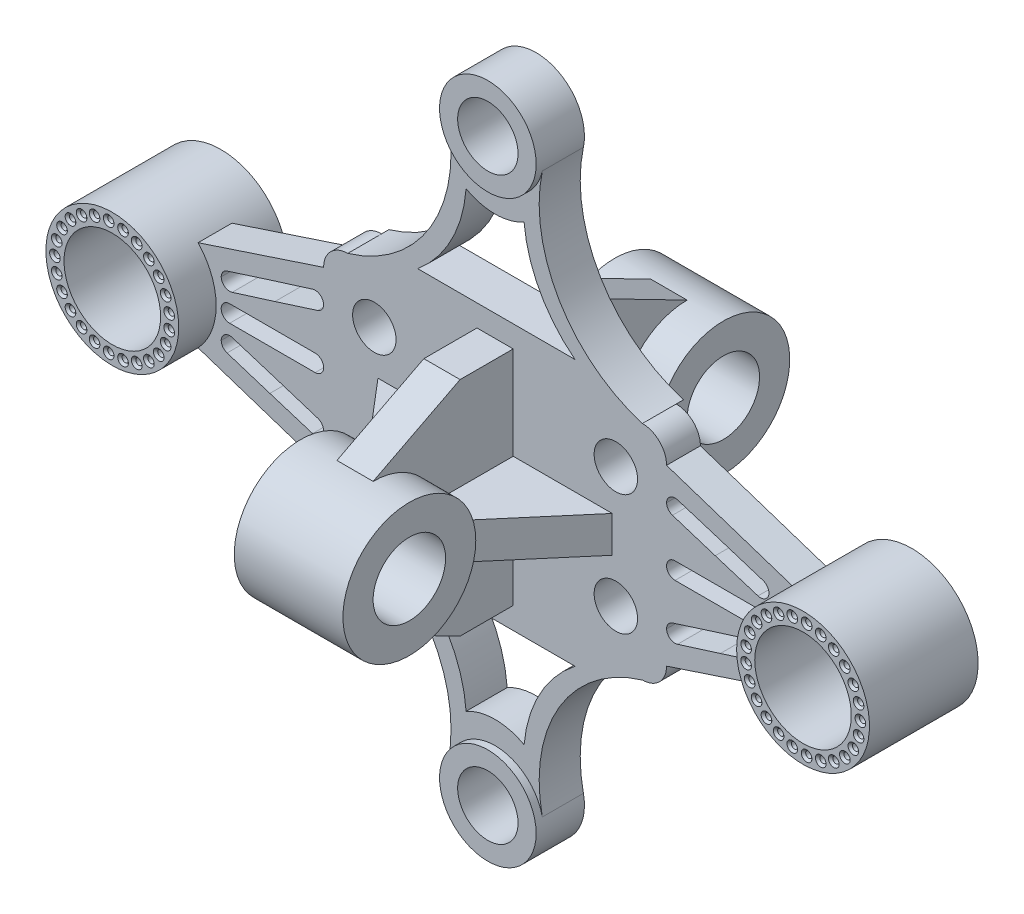
from build123d import *

# Parameters (mm, degrees)
SKETCH1_W                                       = 92
SKETCH1_H                                       = 142
SKETCH1_R                                       = 9
BOSS_EXTRUDE1_DEPTH                             = 14
FILLET1_R                                       = 10
BOSS_EXTRUDE2_DEPTH                             = 22.5
BOSS_EXTRUDE2_DEPTH_BACK                        = 22.5
SKETCH2_R                                       = 27.5
BOSS_EXTRUDE3_DEPTH                             = 7.5
BOSS_EXTRUDE3_DEPTH_BACK                        = 7.5
RIB32_REACH                                     = 132.603
SKETCH8_WALL_W                                  = 303.284863468
SKETCH8_WALL_H                                  = 15
SKETCH9_R                                       = 15
CUT_EXTRUDE1_DEPTH                              = 145.078103819
BOSS_EXTRUDE4_DEPTH                             = 22.5
BOSS_EXTRUDE4_DEPTH_BACK                        = 22.5
SKETCH11_R                                      = 27.5
SKETCH11_R_2                                    = 20
BOSS_EXTRUDE5_DEPTH                             = 7
BOSS_EXTRUDE5_DEPTH_BACK                        = 7
CSK_FOR_M2_FLAT_HEAD_MACHINE_SCREW2_D           = 2.6
CSK_FOR_M2_FLAT_HEAD_MACHINE_SCREW2_CSINK_D     = 4.4
CSK_FOR_M2_FLAT_HEAD_MACHINE_SCREW2_CSINK_ANGLE = 90
CIRPATTERN1_COUNT                               = 25
CUT_EXTRUDE2_DEPTH                              = 203.698051298
BOSS_EXTRUDE6_DEPTH                             = 10
BOSS_EXTRUDE6_DEPTH_BACK                        = 10
SKETCH19_R                                      = 20
SKETCH19_R_2                                    = 12.5
BOSS_EXTRUDE7_DEPTH                             = 7
BOSS_EXTRUDE7_DEPTH_BACK                        = 10


with BuildPart() as part:
    # Sketch1 → Boss-Extrude1 (new body)
    with BuildSketch(Plane(origin=(0, 0, 0), x_dir=(0, 1, 0), z_dir=(0, 0, 1))):
        Rectangle(SKETCH1_W, SKETCH1_H)
        with Locations(Location((-25, -50, 0), (0, 0, 270))):
            Circle(SKETCH1_R, mode=Mode.SUBTRACT)
        with Locations(Location((-25, 50, 0), (0, 0, 270))):
            Circle(SKETCH1_R, mode=Mode.SUBTRACT)
        with Locations(Location((25, 50, 0), (0, 0, 270))):
            Circle(SKETCH1_R, mode=Mode.SUBTRACT)
        with Locations(Location((25, -50, 0), (0, 0, 270))):
            Circle(SKETCH1_R, mode=Mode.SUBTRACT)
    extrude(amount=BOSS_EXTRUDE1_DEPTH)

    # Fillet1
    fillet1_edges = [part.edges().sort_by_distance(p)[0] for p in [
        (71, 46, 7),
        (71, -46, 7),
        (-71, -46, 7),
        (-71, 46, 7),
    ]]
    fillet(fillet1_edges, radius=FILLET1_R)



with BuildPart() as body_2:
    # Sketch2 → Boss-Extrude2 (new, two sides: drawn at the far end of the back side and taken through both)
    with BuildSketch(Plane.YZ.offset(-BOSS_EXTRUDE2_DEPTH_BACK)):
        with Locations(Location((0, 72, 0), (0, 0, 270))):
            Circle(SKETCH2_R)
    extrude(amount=BOSS_EXTRUDE2_DEPTH + BOSS_EXTRUDE2_DEPTH_BACK)


with BuildPart() as part_1:
    add(part.part)

    add(body_2.part)  # Boss-Extrude3 merges body 2
    # Sketch7 → Boss-Extrude3 (add, two sides: drawn at the far end of the back side and taken through both)
    with BuildSketch(Plane.YZ.offset(-BOSS_EXTRUDE3_DEPTH_BACK)):
        with BuildLine():
            Line((-46, 14), (-46, 36))
            Line((-46, 36), (-27.5, 72))
            ThreePointArc((-27.5, 72), (0, 46.820837438), (27.5, 72))
            Line((27.5, 72), (46, 36))
            Line((46, 36), (46, 14))
            Line((46, 14), (-46, 14))
        make_face()
    extrude(amount=BOSS_EXTRUDE3_DEPTH + BOSS_EXTRUDE3_DEPTH_BACK)

    # Sketch8 wall → Rib32 (add, up to next)
    with BuildSketch(Plane(origin=(35.5, 0, 29.25), x_dir=(0.648734176014, 0, -0.761015091093), z_dir=(-0.761015091093, 0, -0.648734176014)), mode=Mode.PRIVATE) as rib32_sk1:
        Rectangle(SKETCH8_WALL_W, SKETCH8_WALL_H)
    rib32_tool1 = extrude(rib32_sk1.sketch, amount=RIB32_REACH, mode=Mode.PRIVATE) - part_1.part
    rib32 = rib32_tool1.solids().sort_by_distance((35.5, 0, 29.25))[0]
    add(rib32)

    # Mirror1: Rib32 across plane
    add(rib32.mirror(Plane(origin=(0, 0, 0), x_dir=(0, 0, 1), z_dir=(1, 0, 0))))

    # Sketch9 → Cut-Extrude1 (cut, through all)
    with BuildSketch(Plane.YZ.offset(22.5)):
        with Locations(Location((0, 72, 0), (0, 0, 270))):
            Circle(SKETCH9_R)
    extrude(amount=-CUT_EXTRUDE1_DEPTH, mode=Mode.SUBTRACT)

    # Mirror3: part across plane


with BuildPart() as part_2:
    add(part_1.part)
    add(part_1.part.mirror(Plane.XY.offset(7)))



with BuildPart() as body_2_2:
    # Sketch11 → Boss-Extrude4 (new, two sides: drawn at the far end of the back side and taken through both)
    with BuildSketch(Plane(origin=(0, 0, 7), x_dir=(0, 1, 0), z_dir=(0, 0, 1)).offset(-BOSS_EXTRUDE4_DEPTH_BACK)):
        with Locations(Location((0, 143, 0), (0, 0, 270))):
            Circle(SKETCH11_R)
        with Locations(Location((0, 143, 0), (0, 0, 270))):
            Circle(SKETCH11_R_2, mode=Mode.SUBTRACT)
    extrude(amount=BOSS_EXTRUDE4_DEPTH + BOSS_EXTRUDE4_DEPTH_BACK)


with BuildPart() as part_3:
    add(part_2.part)

    add(body_2_2.part)  # Boss-Extrude5 merges body 2 2
    # Sketch12 → Boss-Extrude5 (add, two sides: drawn at the far end of the back side and taken through both)
    with BuildSketch(Plane(origin=(0, 0, 7), x_dir=(0, 1, 0), z_dir=(0, 0, 1)).offset(-BOSS_EXTRUDE5_DEPTH_BACK)):
        with BuildLine():
            Line((-18.848192646, 122.97512462), (-36, 71))
            Line((-36, 71), (36, 71))
            Line((36, 71), (18.848192646, 122.97512462))
            ThreePointArc((18.848192646, 122.97512462), (0, 115.5), (-18.848192646, 122.97512462))
        make_face()
    extrude(amount=BOSS_EXTRUDE5_DEPTH + BOSS_EXTRUDE5_DEPTH_BACK)

    # CSK for M2 Flat Head Machine Screw2 (through all)
    with Locations(Plane.XY.offset(29.5)):
        with Locations((-166.75, 0)):
            csk_for_m2_flat_head_machine_screw2 = CounterSinkHole(CSK_FOR_M2_FLAT_HEAD_MACHINE_SCREW2_D / 2, CSK_FOR_M2_FLAT_HEAD_MACHINE_SCREW2_CSINK_D / 2, counter_sink_angle=CSK_FOR_M2_FLAT_HEAD_MACHINE_SCREW2_CSINK_ANGLE)

    # CirPattern1: CSK for M2 Flat Head Machine Screw2 ×25 about axis
    cirpattern1_axis = Axis((-143, 0, 0), (0, 0, 1))
    for i in range(1, CIRPATTERN1_COUNT):
        add(csk_for_m2_flat_head_machine_screw2.rotate(cirpattern1_axis, i * 360 / CIRPATTERN1_COUNT), mode=Mode.SUBTRACT)

    # Sketch18 → Cut-Extrude2 (cut, through all)
    with BuildSketch(Plane.XY.offset(14)):
        with BuildLine():
            Line((-110.955501553, 14.788740235), (-75.547122656, 25.890641216))
            ThreePointArc((-75.547122656, 25.890641216), (-71.160309274, 23.598073146), (-73.452877344, 19.211259765))
            Line((-73.452877344, 19.211259765), (-108.861256242, 8.109358784))
            ThreePointArc((-108.861256242, 8.109358784), (-113.248069623, 10.401926854), (-110.955501553, 14.788740235))
        make_face()
        with BuildLine():
            Line((-108.845035715, -8.019829968), (-73.436656817, -19.311046768))
            ThreePointArc((-73.436656817, -19.311046768), (-71.165438368, -23.708951583), (-75.563343183, -25.980170032))
            Line((-75.563343183, -25.980170032), (-110.971722081, -14.688953232))
            ThreePointArc((-110.971722081, -14.688953232), (-113.242940529, -10.291048417), (-108.845035715, -8.019829968))
        make_face()
        with BuildLine():
            Line((-109.908378898, 3.5), (-74.5, 3.5))
            ThreePointArc((-74.5, 3.5), (-71, 0), (-74.5, -3.5))
            Line((-74.5, -3.5), (-109.908378898, -3.5))
            ThreePointArc((-109.908378898, -3.5), (-113.408378898, 0), (-109.908378898, 3.5))
        make_face()
    extrude(amount=-CUT_EXTRUDE2_DEPTH, mode=Mode.SUBTRACT)

    # Mirror13: part across plane


with BuildPart() as part_4:
    add(part_3.part)
    add(part_3.part.mirror(Plane(origin=(0, 0, 0), x_dir=(0, 0, 1), z_dir=(1, 0, 0))))



with BuildPart() as body_2_3:
    # Sketch19 → Boss-Extrude6 (new, two sides: drawn at the far end of the back side and taken through both)
    with BuildSketch(Plane(origin=(0, 0, 7), x_dir=(0, 1, 0), z_dir=(0, 0, 1)).offset(-BOSS_EXTRUDE6_DEPTH_BACK)):
        with Locations(Location((120, 0, 0), (0, 0, 270))):
            Circle(SKETCH19_R)
        with Locations(Location((120, 0, 0), (0, 0, 270))):
            Circle(SKETCH19_R_2, mode=Mode.SUBTRACT)
    extrude(amount=BOSS_EXTRUDE6_DEPTH + BOSS_EXTRUDE6_DEPTH_BACK)


with BuildPart() as part_5:
    add(part_4.part)

    add(body_2_3.part)  # Boss-Extrude7 merges body 2 3
    # Sketch20 → Boss-Extrude7 (add, two sides: drawn at the far end of the back side and taken through both)
    with BuildSketch(Plane(origin=(0, 0, 7), x_dir=(0, 1, 0), z_dir=(0, 0, 1)).offset(-BOSS_EXTRUDE7_DEPTH_BACK)):
        with BuildLine():
            Line((46, 61), (46, -61))
            ThreePointArc((46, -61), (72.804575858, -26.618850336), (115.824466855, -19.559266933))
            ThreePointArc((115.824466855, -19.559266933), (100, 0), (115.824466855, 19.559266933))
            ThreePointArc((115.824466855, 19.559266933), (72.804575858, 26.618850336), (46, 61))
        make_face()
        with BuildLine():
            Line((55, 32.073495835), (55, -33.088312288))
            ThreePointArc((55, -33.088312288), (72.15253564, -18.520282477), (93.691404874, -12))
            ThreePointArc((93.691404874, -12), (90.596897206, 0), (93.691404874, 12))
            ThreePointArc((93.691404874, 12), (72.294003687, 18.082124982), (55, 32.073495835))
        make_face(mode=Mode.SUBTRACT)
    extrude(amount=BOSS_EXTRUDE7_DEPTH + BOSS_EXTRUDE7_DEPTH_BACK)

    # Mirror14: part across plane


with BuildPart() as part_6:
    add(part_5.part)
    add(part_5.part.mirror(Plane.ZX))


solid = part_6.part
